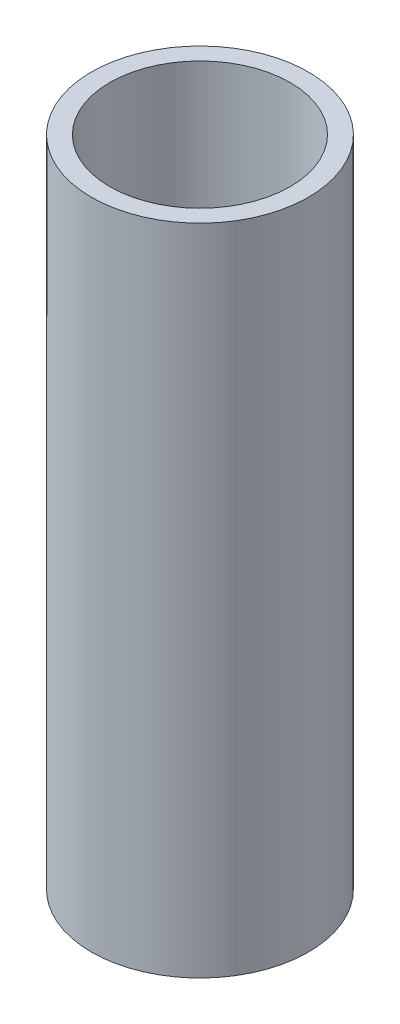
from build123d import *

# Parameters (mm, degrees)
SKETCH1_R           = 21.082
SKETCH1_R_2         = 17.526
BOSS_EXTRUDE1_DEPTH = 127


with BuildPart() as part:
    # Sketch1 → Boss-Extrude1 (new body)
    with BuildSketch(Plane(origin=(0, 0, 0), x_dir=(1, 0, 0), z_dir=(0, 1, 0))):
        with Locations(Location((0, 0, 0), (0, 0, 270))):
            Circle(SKETCH1_R)
        with Locations(Location((0, 0, 0), (0, 0, 270))):
            Circle(SKETCH1_R_2, mode=Mode.SUBTRACT)
    extrude(amount=BOSS_EXTRUDE1_DEPTH)


solid = part.part
